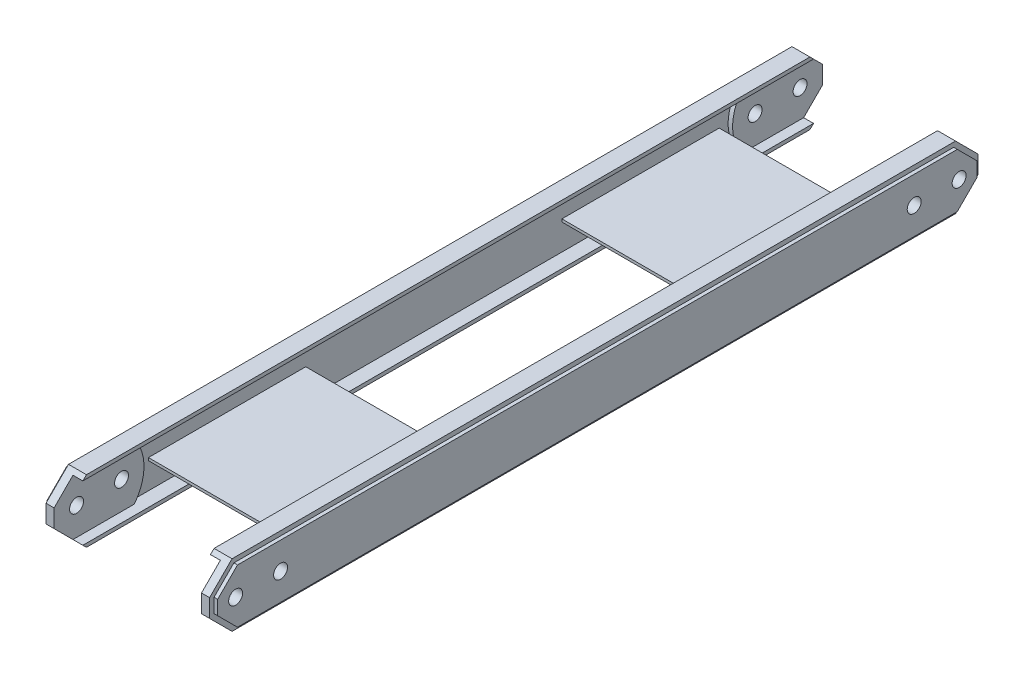
from build123d import *

# Parameters (mm, degrees)
EXTRUDE_1_DEPTH        = 855
EXTRUDE_2_DEPTH        = 10
SKETCH_3_W             = 350
SKETCH_3_H             = 6
EXTRUDE_3_DEPTH        = 174
CUT_EXTRUDE_9_DEPTH    = 932.891088057
EXTRUDE_7_DEPTH        = 8
PATTERN_LINEAR_1_COUNT = 2
PATTERN_LINEAR_1_PITCH = 372
SKETCH_9_R             = 15.5
CUT_EXTRUDE_10_DEPTH   = 939.256361556


with BuildPart() as part:
    # 草图1 → 拉伸1 (new body)
    with BuildSketch(Plane.XY):
        Polygon((-150, 70), (-190, 70), (-190, -70), (-150, -70), (-150, -62), (-182, -62), (-182, 62), (-150, 62), align=None)
    extrude(amount=EXTRUDE_1_DEPTH)

    # 草图2 → 拉伸2 (add)
    with BuildSketch(Plane(origin=(-182, 0, 0), x_dir=(0, 0, -1), z_dir=(1, 0, 0))):
        with BuildLine():
            Line((-676.539819016, 62), (-855, 62))
            Line((-855, 62), (-855, -62))
            Line((-855, -62), (-676.539819016, -62))
            ThreePointArc((-676.539819016, -62), (-655, 0), (-676.539819016, 62))
        make_face()
    extrude(amount=EXTRUDE_2_DEPTH)

    # 草图3 → 拉伸3 (add)
    with BuildSketch(Plane(origin=(-182, 0, 0), x_dir=(0, 0, -1), z_dir=(1, 0, 0))):
        with Locations((-460, -1)):
            Rectangle(SKETCH_3_W, SKETCH_3_H)
    extrude(amount=EXTRUDE_3_DEPTH)

    # 镜向1: part across plane


with BuildPart() as part_1:
    add(part.part)
    add(part.part.mirror(Plane(origin=(-8, -4, 635), x_dir=(0, 0, 1), z_dir=(1, 0, 0))))

    # 草图8 → 拉伸9 (cut, through all)
    with BuildSketch(Plane.ZY.offset(190)):
        Polygon((805, 70), (855, 70), (855, 20), align=None)
        Polygon((855, -70), (855, -20), (805, -70), align=None)
    extrude(amount=-CUT_EXTRUDE_9_DEPTH, mode=Mode.SUBTRACT)

    # 镜向2: part across plane


with BuildPart() as part_2:
    add(part_1.part)
    add(part_1.part.mirror(Plane.XY))

    # 草图6 → 拉伸7 (add)
    with BuildSketch(Plane.ZY.offset(190)):
        Polygon((-800.857864376, 60), (-845, 15.857864376), (-845, -15.857864376), (-800.857864376, -60), (800.857864376, -60), (845, -15.857864376), (845, 15.857864376), (800.857864376, 60), align=None)
    extrude_7 = extrude(amount=EXTRUDE_7_DEPTH)

    # 阵列(线性)1: 拉伸7 ×2
    with Locations(*[(i * PATTERN_LINEAR_1_PITCH, 0, 0) for i in range(1, PATTERN_LINEAR_1_COUNT)]):
        add(extrude_7)

    # 草图9 → 拉伸10 (cut, through all)
    with BuildSketch(Plane.ZY.offset(198)):
        with Locations((-805, 0)):
            Circle(SKETCH_9_R)
        with Locations((-705, 0)):
            Circle(SKETCH_9_R)
        with Locations(Location((705, 0, 0), (0, 0, 90))):
            Circle(SKETCH_9_R)
        with Locations(Location((805, 0, 0), (0, 0, 90))):
            Circle(SKETCH_9_R)
    extrude(amount=-CUT_EXTRUDE_10_DEPTH, mode=Mode.SUBTRACT)


solid = part_2.part
